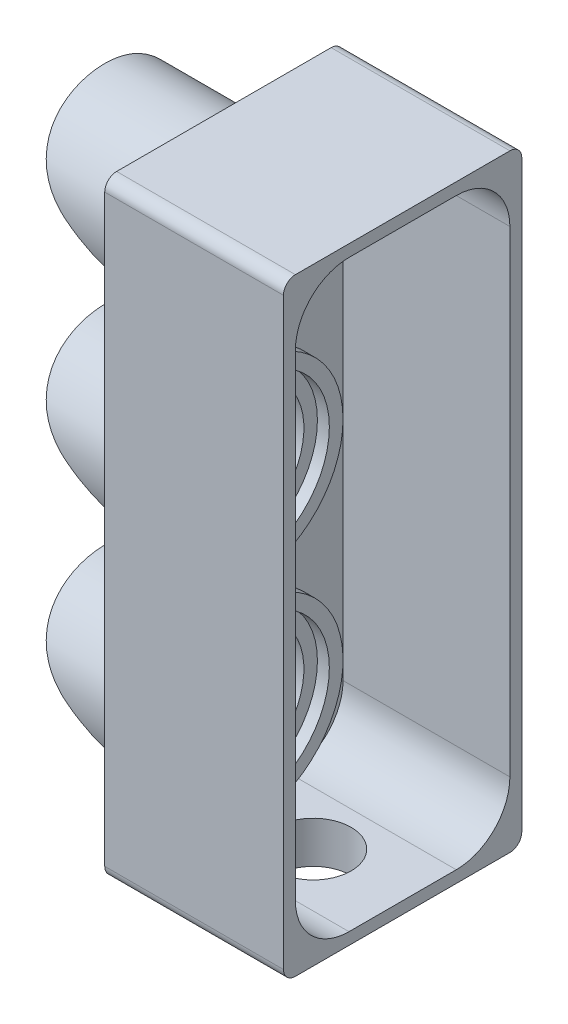
from build123d import *

# Parameters (mm, degrees)
SKETCH1_W                      = 40
SKETCH1_H                      = 102
BOSS_EXTRUDE1_DEPTH            = 30
SHELL1_T                       = -2
CUT_EXTRUDE1_REACH             = 95.252
SKETCH2_R                      = 11.43
BOSS_EXTRUDE2_START            = 20
SKETCH3_R                      = 12.7
SKETCH3_R_2                    = 11.43
BOSS_EXTRUDE2_DEPTH            = 20
CUT_EXTRUDE2_REACH             = 95.252
CUT_EXTRUDE2_DIRECTION_2_REACH = 95.252
LPATTERN1_COUNT                = 3
LPATTERN1_PITCH                = 35
SKETCH5_R                      = 16
SKETCH5_R_2                    = 13.7
BOSS_EXTRUDE3_DEPTH            = 2
FILLET1_R                      = 2
CUT_EXTRUDE3_REACH             = 110.185
SKETCH6_R                      = 6.35
BOSS_EXTRUDE4_START            = 5
SKETCH7_R                      = 7.35
SKETCH7_R_2                    = 6.35
BOSS_EXTRUDE4_DEPTH            = 5
FILLET6_R                      = 9


with BuildPart() as part:
    # Sketch1 → Boss-Extrude1 (new body)
    with BuildSketch(Plane(origin=(0, 0, 0), x_dir=(0, 0, -1), z_dir=(1, 0, 0))):
        with Locations((0, 35)):
            Rectangle(SKETCH1_W, SKETCH1_H)
    extrude(amount=BOSS_EXTRUDE1_DEPTH)

    # Shell1
    shell1_openings = [part.faces().sort_by_distance(p)[0] for p in [
        (30, 35, 0),
    ]]
    offset(amount=SHELL1_T, openings=shell1_openings, kind=Kind.INTERSECTION)

    # Sketch2 → Cut-Extrude1 (cut, up to next)
    with BuildSketch(Plane.ZY, mode=Mode.PRIVATE) as cut_extrude1_sk1:
        Circle(SKETCH2_R)
    cut_extrude1_tool1 = extrude(cut_extrude1_sk1.sketch, amount=-CUT_EXTRUDE1_REACH, mode=Mode.PRIVATE) & part.part
    # Sketch2 → Cut-Extrude1 (cut, up to next)
    with BuildSketch(Plane.ZY, mode=Mode.PRIVATE) as cut_extrude1_sk2:
        with Locations((0, 35)):
            Circle(SKETCH2_R)
    cut_extrude1_tool2 = extrude(cut_extrude1_sk2.sketch, amount=-CUT_EXTRUDE1_REACH, mode=Mode.PRIVATE) & part.part
    # Sketch2 → Cut-Extrude1 (cut, up to next)
    with BuildSketch(Plane.ZY, mode=Mode.PRIVATE) as cut_extrude1_sk3:
        with Locations((0, 70)):
            Circle(SKETCH2_R)
    cut_extrude1_tool3 = extrude(cut_extrude1_sk3.sketch, amount=-CUT_EXTRUDE1_REACH, mode=Mode.PRIVATE) & part.part
    add(cut_extrude1_tool1.solids().sort_by_distance((0, 0, 0))[0], mode=Mode.SUBTRACT)
    add(cut_extrude1_tool2.solids().sort_by_distance((0, 35, 0))[0], mode=Mode.SUBTRACT)
    add(cut_extrude1_tool3.solids().sort_by_distance((0, 70, 0))[0], mode=Mode.SUBTRACT)

    # Sketch3 → Boss-Extrude2 (add)
    # profile 1 of 3: a face of its own
    with BuildSketch(Plane.ZY.offset(BOSS_EXTRUDE2_START)):
        Circle(SKETCH3_R)
        Circle(SKETCH3_R_2, mode=Mode.SUBTRACT)
    # profile 2 of 3: a face of its own
    with BuildSketch(Plane.ZY.offset(BOSS_EXTRUDE2_START)):
        with Locations((0, 35)):
            Circle(SKETCH3_R)
        with Locations((0, 35)):
            Circle(SKETCH3_R_2, mode=Mode.SUBTRACT)
    # profile 3 of 3: a face of its own
    with BuildSketch(Plane.ZY.offset(BOSS_EXTRUDE2_START)):
        with Locations((0, 70)):
            Circle(SKETCH3_R)
        with Locations((0, 70)):
            Circle(SKETCH3_R_2, mode=Mode.SUBTRACT)
    extrude(amount=-BOSS_EXTRUDE2_DEPTH)

    # Sketch4 → Cut-Extrude2 (cut, up to next)
    with BuildSketch(Plane.XY, mode=Mode.PRIVATE) as cut_extrude2_sk1:
        with BuildLine():
            ThreePointArc((-20, 82.7), (-18.317957439, 75.380446755), (-13.811148901, 69.372634868))
            Line((-13.811148901, 69.372634868), (0, 57.3))
            Line((0, 57.3), (-20, 57.3))
            Line((-20, 57.3), (-20, 82.7))
        make_face()
    cut_extrude2_tool1 = extrude(cut_extrude2_sk1.sketch, amount=-CUT_EXTRUDE2_REACH, mode=Mode.PRIVATE) & part.part
    cut_extrude2 = cut_extrude2_tool1.solids().sort_by_distance((-13.600187, 63.733143, 0))[0]
    add(cut_extrude2, mode=Mode.SUBTRACT)

    # Sketch4 → Cut-Extrude2 direction 2 (cut, up to next)
    with BuildSketch(Plane.XY, mode=Mode.PRIVATE) as cut_extrude2_direction_2_sk1:
        with BuildLine():
            ThreePointArc((-20, 82.7), (-18.317957439, 75.380446755), (-13.811148901, 69.372634868))
            Line((-13.811148901, 69.372634868), (0, 57.3))
            Line((0, 57.3), (-20, 57.3))
            Line((-20, 57.3), (-20, 82.7))
        make_face()
    cut_extrude2_direction_2_tool1 = extrude(cut_extrude2_direction_2_sk1.sketch, amount=CUT_EXTRUDE2_DIRECTION_2_REACH, mode=Mode.PRIVATE) & part.part
    cut_extrude2_direction_2 = cut_extrude2_direction_2_tool1.solids().sort_by_distance((-13.600187, 63.733143, 0))[0]
    add(cut_extrude2_direction_2, mode=Mode.SUBTRACT)

    # LPattern1: Cut-Extrude2, Cut-Extrude2 direction 2 ×3
    with Locations(*[(0, -i * LPATTERN1_PITCH, 0) for i in range(1, LPATTERN1_COUNT)]):
        add(cut_extrude2, mode=Mode.SUBTRACT)
        add(cut_extrude2_direction_2, mode=Mode.SUBTRACT)

    # Sketch5 → Boss-Extrude3 (add)
    # profile 1 of 3: a face of its own
    with BuildSketch(Plane(origin=(2, 0, 0), x_dir=(0, 0, -1), z_dir=(1, 0, 0))):
        with Locations((0, 70)):
            Circle(SKETCH5_R)
        with Locations((0, 70)):
            Circle(SKETCH5_R_2, mode=Mode.SUBTRACT)
    # profile 2 of 3: a face of its own
    with BuildSketch(Plane(origin=(2, 0, 0), x_dir=(0, 0, -1), z_dir=(1, 0, 0))):
        with Locations(Location((0, 35, 0), (0, 0, 180))):
            Circle(SKETCH5_R)
        with Locations((0, 35)):
            Circle(SKETCH5_R_2, mode=Mode.SUBTRACT)
    # profile 3 of 3: a face of its own
    with BuildSketch(Plane(origin=(2, 0, 0), x_dir=(0, 0, -1), z_dir=(1, 0, 0))):
        Circle(SKETCH5_R)
        Circle(SKETCH5_R_2, mode=Mode.SUBTRACT)
    extrude(amount=BOSS_EXTRUDE3_DEPTH)

    # Fillet1
    fillet1_edges = [part.edges().sort_by_distance(p)[0] for p in [
        (15, 86, 20),
        (15, -16, 20),
        (15, -16, -20),
        (15, 86, -20),
    ]]
    fillet(fillet1_edges, radius=FILLET1_R)

    # Sketch6 → Cut-Extrude3 (cut, up to next)
    with BuildSketch(Plane.XZ.offset(16), mode=Mode.PRIVATE) as cut_extrude3_sk1:
        with Locations(Location((15, 0, 0), (0, 0, 270))):
            Circle(SKETCH6_R)
    cut_extrude3_tool1 = extrude(cut_extrude3_sk1.sketch, amount=-CUT_EXTRUDE3_REACH, mode=Mode.PRIVATE) & part.part
    add(cut_extrude3_tool1.solids().sort_by_distance((15, -16, 0))[0], mode=Mode.SUBTRACT)

    # Sketch7 → Boss-Extrude4 (add)
    with BuildSketch(Plane.XZ.offset(16).offset(BOSS_EXTRUDE4_START)):
        with Locations(Location((15, 0, 0), (0, 0, 90))):
            Circle(SKETCH7_R)
        with Locations(Location((15, 0, 0), (0, 0, 270))):
            Circle(SKETCH7_R_2, mode=Mode.SUBTRACT)
    extrude(amount=-BOSS_EXTRUDE4_DEPTH)

    # Fillet6
    fillet6_edges = [part.edges().sort_by_distance(p)[0] for p in [
        (16, 84, -18),
        (16, 84, 18),
        (16, -14, 18),
        (16, -14, -18),
    ]]
    fillet(fillet6_edges, radius=FILLET6_R)


solid = part.part
